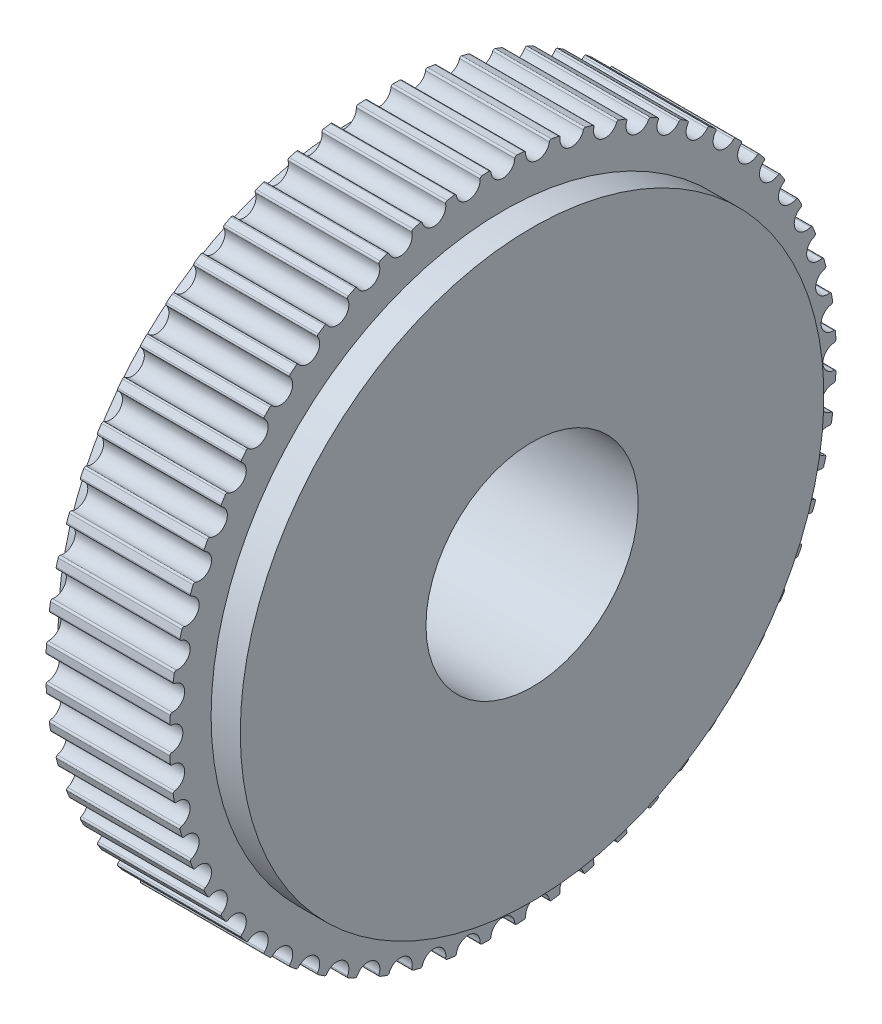
from build123d import *

# Parameters (mm, degrees)
CUT_EXTRUDE1_DEPTH       = 29.01946734
FILLET1_R                = 0.1
CIRPATTERN1_COUNT        = 60
FILLET1_OF_CIRPATTERN1_R = 0.1


with BuildPart() as part:
    # Sketch1 → Revolve1 (revolve)
    with BuildSketch(Plane.XY, mode=Mode.PRIVATE) as revolve1_sk:
        Polygon((1.65, 18.845), (8.65, 18.845), (8.65, 16.5), (10.3, 16.5), (10.3, 6), (0, 6), (0, 16.5), (1.65, 16.5), align=None)
    revolve(revolve1_sk.sketch.rotate(Axis((0, 0, 0), (1, 0, 0)), 90), axis=Axis((0, 0, 0), (1, 0, 0)))

    # Sketch2 → Cut-Extrude1 (cut, through all)
    with BuildSketch(Plane(origin=(1.65, 0, 0), x_dir=(0, 0, -1), z_dir=(1, 0, 0))):
        with BuildLine():
            ThreePointArc((0.672052371, 18.833012786), (0, 18.845), (-0.672052371, 18.833012786))
            ThreePointArc((-0.672052371, 18.833012786), (0, 18.095), (0.672052371, 18.833012786))
        make_face()
    cut_extrude1 = extrude(amount=CUT_EXTRUDE1_DEPTH, mode=Mode.SUBTRACT)

    # Fillet1
    fillet1_edges = [part.edges().sort_by_distance(p)[0] for p in [
        (5.15, 18.833012786, 0.672052371),
        (5.15, 18.833012786, -0.672052371),
    ]]
    fillet(fillet1_edges, radius=FILLET1_R)

    # CirPattern1: Cut-Extrude1 ×60 about axis
    cirpattern1_axis = Axis((0, 0, 0), (1, 0, 0))
    for i in range(1, CIRPATTERN1_COUNT):
        add(cut_extrude1.rotate(cirpattern1_axis, i * 360 / CIRPATTERN1_COUNT), mode=Mode.SUBTRACT)

    # Fillet1 of CirPattern1
    fillet1_of_cirpattern1_edges = [part.edges().sort_by_distance(p)[0] for p in [
        (5.15, 18.65959497, 2.636956683),
        (5.15, 18.800092173, 1.300215088),
        (5.15, 18.281738727, 4.572969945),
        (5.15, 18.561193816, 3.258237118),
        (5.15, 17.703583928, 6.458880793),
        (5.15, 18.118935136, 5.18056122),
        (5.15, 16.93146496, 8.27402679),
        (5.15, 17.47816161, 7.046126009),
        (5.15, 15.973841318, 9.998520819),
        (5.15, 16.645893688, 8.834491968),
        (5.15, 14.841204927, 11.613468961),
        (5.15, 15.631249872, 10.526065383),
        (5.15, 13.54596519, 13.101177507),
        (5.15, 14.445346811, 12.102313024),
        (5.15, 12.102313024, 14.445346811),
        (5.15, 13.101177507, 13.54596519),
        (5.15, 10.526065383, 15.631249872),
        (5.15, 11.613468961, 14.841204927),
        (5.15, 8.834491968, 16.645893688),
        (5.15, 9.998520819, 15.973841318),
        (5.15, 7.046126009, 17.47816161),
        (5.15, 8.27402679, 16.93146496),
        (5.15, 5.18056122, 18.118935136),
        (5.15, 6.458880793, 17.703583928),
        (5.15, 3.258237118, 18.561193816),
        (5.15, 4.572969945, 18.281738727),
        (5.15, 1.300215088, 18.800092173),
        (5.15, 2.636956683, 18.65959497),
        (5.15, -0.672052371, 18.833012786),
        (5.15, 0.672052371, 18.833012786),
        (5.15, -2.636956683, 18.65959497),
        (5.15, -1.300215088, 18.800092173),
        (5.15, -4.572969945, 18.281738727),
        (5.15, -3.258237118, 18.561193816),
        (5.15, -6.458880793, 17.703583928),
        (5.15, -5.18056122, 18.118935136),
        (5.15, -8.27402679, 16.93146496),
        (5.15, -7.046126009, 17.47816161),
        (5.15, -9.998520819, 15.973841318),
        (5.15, -8.834491968, 16.645893688),
        (5.15, -11.613468961, 14.841204927),
        (5.15, -10.526065383, 15.631249872),
        (5.15, -13.101177507, 13.54596519),
        (5.15, -12.102313024, 14.445346811),
        (5.15, -14.445346811, 12.102313024),
        (5.15, -13.54596519, 13.101177507),
        (5.15, -15.631249872, 10.526065383),
        (5.15, -14.841204927, 11.613468961),
        (5.15, -16.645893688, 8.834491968),
        (5.15, -15.973841318, 9.998520819),
        (5.15, -17.47816161, 7.046126009),
        (5.15, -16.93146496, 8.27402679),
        (5.15, -18.118935136, 5.18056122),
        (5.15, -17.703583928, 6.458880793),
        (5.15, -18.561193816, 3.258237118),
        (5.15, -18.281738727, 4.572969945),
        (5.15, -18.800092173, 1.300215088),
        (5.15, -18.65959497, 2.636956683),
        (5.15, -18.833012786, -0.672052371),
        (5.15, -18.833012786, 0.672052371),
        (5.15, -18.65959497, -2.636956683),
        (5.15, -18.800092173, -1.300215088),
        (5.15, -18.281738727, -4.572969945),
        (5.15, -18.561193816, -3.258237118),
        (5.15, -17.703583928, -6.458880793),
        (5.15, -18.118935136, -5.18056122),
        (5.15, -16.93146496, -8.27402679),
        (5.15, -17.47816161, -7.046126009),
        (5.15, -15.973841318, -9.998520819),
        (5.15, -16.645893688, -8.834491968),
        (5.15, -14.841204927, -11.613468961),
        (5.15, -15.631249872, -10.526065383),
        (5.15, -13.54596519, -13.101177507),
        (5.15, -14.445346811, -12.102313024),
        (5.15, -12.102313024, -14.445346811),
        (5.15, -13.101177507, -13.54596519),
        (5.15, -10.526065383, -15.631249872),
        (5.15, -11.613468961, -14.841204927),
        (5.15, -8.834491968, -16.645893688),
        (5.15, -9.998520819, -15.973841318),
        (5.15, -7.046126009, -17.47816161),
        (5.15, -8.27402679, -16.93146496),
        (5.15, -5.18056122, -18.118935136),
        (5.15, -6.458880793, -17.703583928),
        (5.15, -3.258237118, -18.561193816),
        (5.15, -4.572969945, -18.281738727),
        (5.15, -1.300215088, -18.800092173),
        (5.15, -2.636956683, -18.65959497),
        (5.15, 0.672052371, -18.833012786),
        (5.15, -0.672052371, -18.833012786),
        (5.15, 2.636956683, -18.65959497),
        (5.15, 1.300215088, -18.800092173),
        (5.15, 4.572969945, -18.281738727),
        (5.15, 3.258237118, -18.561193816),
        (5.15, 6.458880793, -17.703583928),
        (5.15, 5.18056122, -18.118935136),
        (5.15, 8.27402679, -16.93146496),
        (5.15, 7.046126009, -17.47816161),
        (5.15, 9.998520819, -15.973841318),
        (5.15, 8.834491968, -16.645893688),
        (5.15, 11.613468961, -14.841204927),
        (5.15, 10.526065383, -15.631249872),
        (5.15, 13.101177507, -13.54596519),
        (5.15, 12.102313024, -14.445346811),
        (5.15, 14.445346811, -12.102313024),
        (5.15, 13.54596519, -13.101177507),
        (5.15, 15.631249872, -10.526065383),
        (5.15, 14.841204927, -11.613468961),
        (5.15, 16.645893688, -8.834491968),
        (5.15, 15.973841318, -9.998520819),
        (5.15, 17.47816161, -7.046126009),
        (5.15, 16.93146496, -8.27402679),
        (5.15, 18.118935136, -5.18056122),
        (5.15, 17.703583928, -6.458880793),
        (5.15, 18.561193816, -3.258237118),
        (5.15, 18.281738727, -4.572969945),
        (5.15, 18.800092173, -1.300215088),
        (5.15, 18.65959497, -2.636956683),
    ]]
    fillet(fillet1_of_cirpattern1_edges, radius=FILLET1_OF_CIRPATTERN1_R)


solid = part.part
